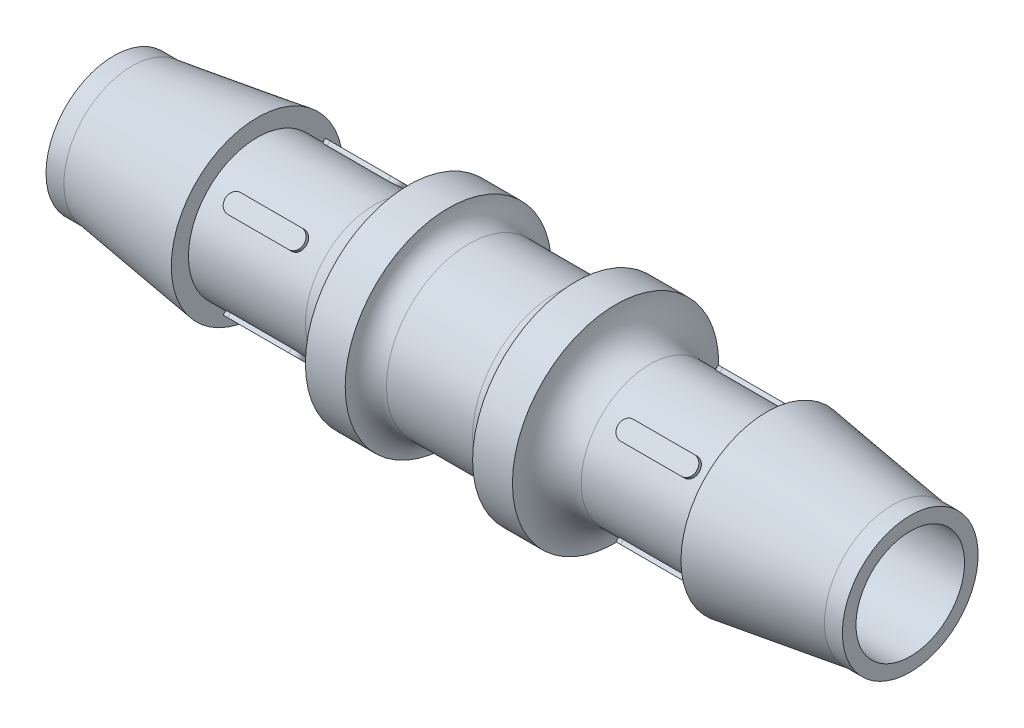
from build123d import *

# Parameters (mm, degrees)
EXTRUDE1_DEPTH     = 6.08076
CIRPATTERN1_COUNT  = 2
CIRPATTERN1_ANGLE  = 90
SKETCH4_R          = 4.572
CUT_EXTRUDE1_DEPTH = 36.707811179


with BuildPart() as part:
    # Sketch1 → Revolve1 (revolve)
    with BuildSketch(Plane.XY, mode=Mode.PRIVATE) as revolve1_sk:
        Polygon((33.528, 4.572), (33.528, 5.715), (32.01924, 5.715), (21.45792, 7.239), (21.45792, 5.7912), (8.71728, 5.7912), (8.71728, 8.6868), (5.36448, 8.6868), (5.36448, 6.94944), (0, 6.94944), (0, 4.572), align=None)
    revolve(revolve1_sk.sketch.rotate(Axis((0, 0, 0), (1, 0, 0)), 90), axis=Axis((0, 0, 0), (1, 0, 0)))

    # Sketch2 → Revolve2 (revolve)
    with BuildSketch(Plane.XY, mode=Mode.PRIVATE) as revolve2_sk:
        with BuildLine():
            Line((11.61288, 5.7912), (8.71728, 5.7912))
            Line((8.71728, 5.7912), (8.71728, 8.6868))
            ThreePointArc((8.71728, 8.6868), (9.565381604, 6.639301604), (11.61288, 5.7912))
        make_face()
        with BuildLine():
            Line((5.36448, 8.6868), (5.36448, 6.94944))
            Line((5.36448, 6.94944), (3.62712, 6.94944))
            ThreePointArc((3.62712, 6.94944), (4.855619037, 7.458300963), (5.36448, 8.6868))
        make_face()
    revolve(revolve2_sk.sketch.rotate(Axis((0, 0, 0), (1, 0, 0)), 90), axis=Axis((0, 0, 0), (1, 0, 0)))

    # Sketch3 → Extrude1 (add, symmetric)
    with BuildSketch(Plane(origin=(0, 0, 0), x_dir=(-1, 0, 0), z_dir=(0, 0.7071067811865488, 0.7071067811865462))):
        with BuildLine():
            Line((-13.970508, 0.75438), (-19.100292, 0.75438))
            ThreePointArc((-19.100292, 0.75438), (-19.854672, 0), (-19.100292, -0.75438))
            Line((-19.100292, -0.75438), (-13.970508, -0.75438))
            ThreePointArc((-13.970508, -0.75438), (-13.216128, 0), (-13.970508, 0.75438))
        make_face()
    extrude1 = extrude(amount=EXTRUDE1_DEPTH, both=True)

    # CirPattern1: Extrude1 ×2 about axis
    cirpattern1_axis = Axis((0, 0, 0), (1, 0, 0))
    for i in range(1, CIRPATTERN1_COUNT):
        add(extrude1.rotate(cirpattern1_axis, i * CIRPATTERN1_ANGLE / (CIRPATTERN1_COUNT - 1)))

    # Sketch4 → Cut-Extrude1 (cut, through all)
    with BuildSketch(Plane(origin=(33.528, 0, 0), x_dir=(0, 0, -1), z_dir=(1, 0, 0))):
        with Locations(Location((0, 0, 0), (0, 0, 180))):
            Circle(SKETCH4_R)
    extrude(amount=-CUT_EXTRUDE1_DEPTH, mode=Mode.SUBTRACT)

    # Mirror1: part across plane


with BuildPart() as part_1:
    add(part.part)
    add(part.part.mirror(Plane(origin=(0, 0, 0), x_dir=(0, 0, 1), z_dir=(1, 0, 0))))


solid = part_1.part
